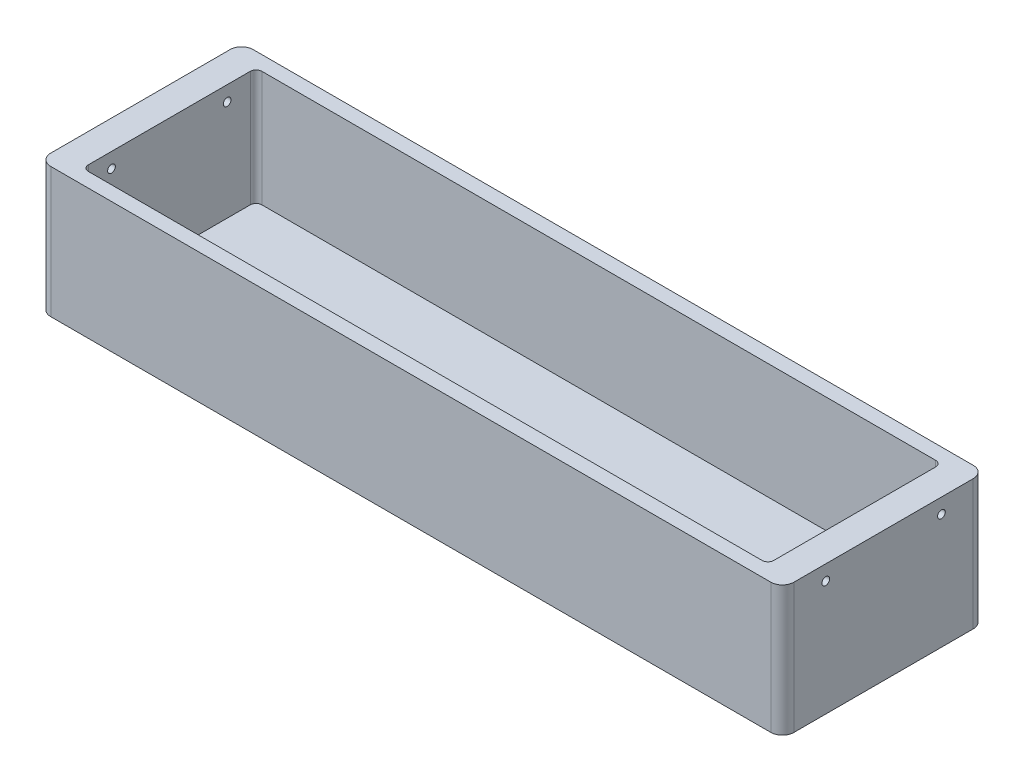
from build123d import *

# Parameters (mm, degrees)
SKETCH1_W           = 326.39
SKETCH1_H           = 88.9
SKETCH1_W_2         = 300.99
SKETCH1_H_2         = 76.2
BOSS_EXTRUDE1_DEPTH = 50.8
SKETCH2_W           = 326.39
SKETCH2_H           = 88.9
BOSS_EXTRUDE2_DEPTH = 6.35
SKETCH3_R           = 3.1
CUT_EXTRUDE1_DEPTH  = 179.534402917
SKETCH4_R           = 1.6875
CUT_EXTRUDE3_DEPTH  = 313.69
FILLET1_R           = 5.08
FILLET2_R           = 2.54


with BuildPart() as part:
    # Sketch1 → Boss-Extrude1 (new body)
    with BuildSketch(Plane(origin=(0, 0, 0), x_dir=(1, 0, 0), z_dir=(0, 1, 0))):
        Rectangle(SKETCH1_W, SKETCH1_H)
        Rectangle(SKETCH1_W_2, SKETCH1_H_2, mode=Mode.SUBTRACT)
    extrude(amount=BOSS_EXTRUDE1_DEPTH)

    # Sketch2 → Boss-Extrude2 (add)
    with BuildSketch(Plane.XZ):
        Rectangle(SKETCH2_W, SKETCH2_H)
    extrude(amount=BOSS_EXTRUDE2_DEPTH)

    # Sketch3 → Cut-Extrude1 (cut, through all)
    with BuildSketch(Plane.XZ.offset(6.35)):
        with Locations(Location((-106, 7.5, 0), (0, 0, 270))):
            Circle(SKETCH3_R)
        with Locations(Location((-106, -7.5, 0), (0, 0, 270))):
            Circle(SKETCH3_R)
    extrude(amount=-CUT_EXTRUDE1_DEPTH, mode=Mode.SUBTRACT)

    # Sketch4 → Cut-Extrude3 (cut)
    with BuildSketch(Plane(origin=(163.195, 0, 0), x_dir=(0, 0, -1), z_dir=(1, 0, 0))):
        with Locations((25.4, 44.22394)):
            Circle(SKETCH4_R)
        with Locations(Location((-25.4, 44.22394, 0), (0, 0, 180))):
            Circle(SKETCH4_R)
    cut_extrude3 = extrude(amount=-CUT_EXTRUDE3_DEPTH, mode=Mode.SUBTRACT)

    # Mirror2: Cut-Extrude3 across plane
    add(cut_extrude3.mirror(Plane(origin=(0, 0, 0), x_dir=(0, 0, 1), z_dir=(1, 0, 0))), mode=Mode.SUBTRACT)

    # Fillet1
    fillet1_edges = [part.edges().sort_by_distance(p)[0] for p in [
        (163.195, 22.225, 44.45),
        (-163.195, 22.225, 44.45),
        (-163.195, 22.225, -44.45),
        (163.195, 22.225, -44.45),
    ]]
    fillet(fillet1_edges, radius=FILLET1_R)

    # Fillet2
    fillet2_edges = [part.edges().sort_by_distance(p)[0] for p in [
        (150.495, 25.4, 38.1),
        (150.495, 25.4, -38.1),
        (-150.495, 25.4, -38.1),
        (-150.495, 25.4, 38.1),
    ]]
    fillet(fillet2_edges, radius=FILLET2_R)


solid = part.part
